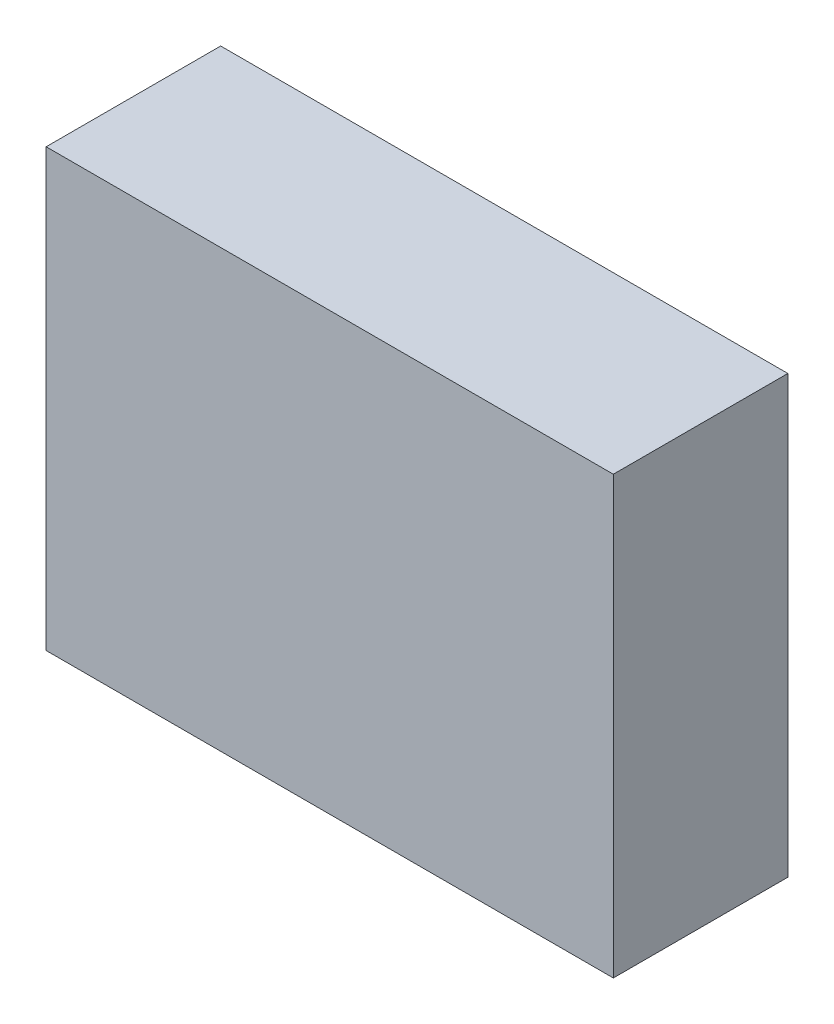
from build123d import *

# Parameters (mm, degrees)
SKETCH1_W           = 130
SKETCH1_H           = 40
BOSS_EXTRUDE1_DEPTH = 100


with BuildPart() as part:
    # Sketch1 → Boss-Extrude1 (new body)
    with BuildSketch(Plane(origin=(0, 0, 0), x_dir=(1, 0, 0), z_dir=(0, 1, 0))):
        with Locations((0, -4.348534202)):
            Rectangle(SKETCH1_W, SKETCH1_H)
    extrude(amount=BOSS_EXTRUDE1_DEPTH)


solid = part.part
